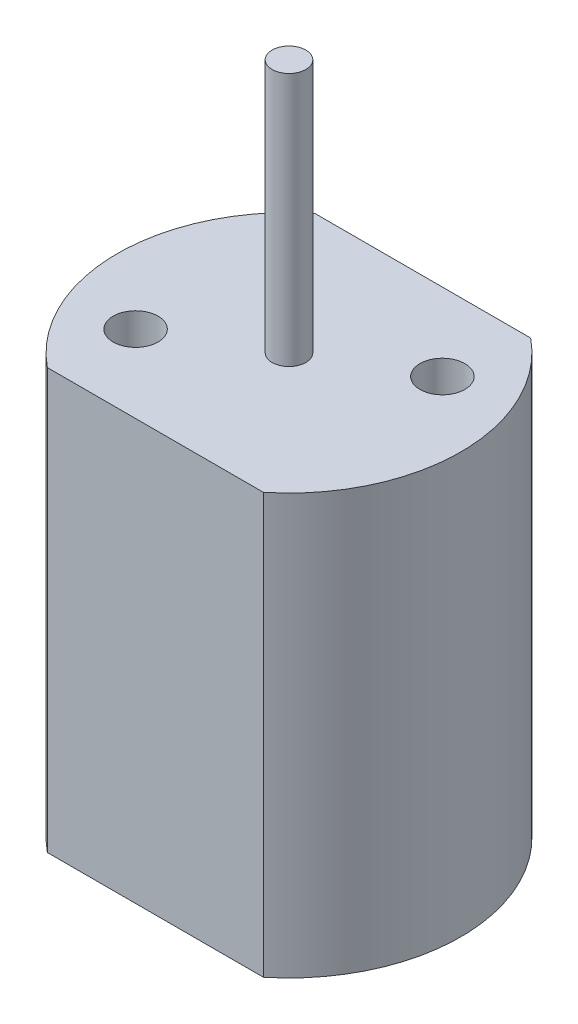
from build123d import *

# Parameters (mm, degrees)
EXTRUDE_1_DEPTH     = 18.7
SKETCH_2_R          = 0.75
EXTRUDE_2_DEPTH     = 11.3
SKETCH_3_R          = 1
CUT_EXTRUDE_1_DEPTH = 3


with BuildPart() as part:
    # 草图1 → 凸台-拉伸1 (new body)
    with BuildSketch(Plane(origin=(0, 0, 0), x_dir=(1, 0, 0), z_dir=(0, 1, 0))):
        with BuildLine():
            Line((4.808326112, 5.95), (-4.808326112, 5.95))
            ThreePointArc((-4.808326112, 5.95), (-7.65, 0), (-4.808326112, -5.95))
            Line((-4.808326112, -5.95), (4.808326112, -5.95))
            ThreePointArc((4.808326112, -5.95), (7.65, 0), (4.808326112, 5.95))
        make_face()
    extrude(amount=EXTRUDE_1_DEPTH)

    # 草图2 → 凸台-拉伸2 (add)
    with BuildSketch(Plane(origin=(0, 18.7, 0), x_dir=(1, 0, 0), z_dir=(0, 1, 0))):
        with Locations(Location((0, 0, 0), (0, 0, 270))):
            Circle(SKETCH_2_R)
    extrude(amount=EXTRUDE_2_DEPTH)

    # 草图3 → 切除-拉伸1 (cut)
    with BuildSketch(Plane(origin=(0, 18.7, 0), x_dir=(1, 0, 0), z_dir=(0, 1, 0))):
        with Locations(Location((4.330127019, 2.5, 0), (0, 0, 270))):
            Circle(SKETCH_3_R)
        with Locations(Location((-4.330127019, -2.5, 0), (0, 0, 270))):
            Circle(SKETCH_3_R)
    extrude(amount=-CUT_EXTRUDE_1_DEPTH, mode=Mode.SUBTRACT)


solid = part.part
